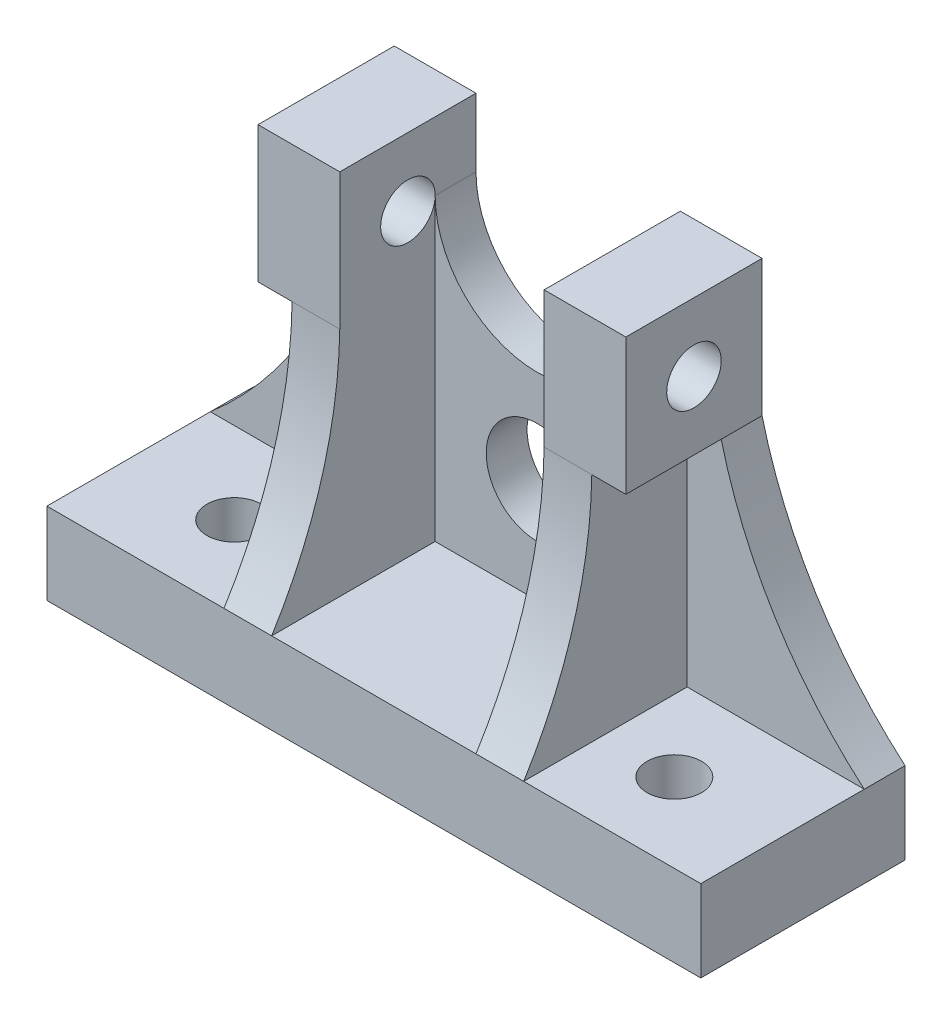
from build123d import *

# Parameters (mm, degrees)
SKETCH1_W             = 96
SKETCH1_H             = 12
BOSS_EXTRUDE1_DEPTH   = 30
SKETCH1_3_R           = 7.5
BOSS_EXTRUDE2_DEPTH   = 6
SKETCH1_4_W           = 12
SKETCH1_4_H           = 20
BOSS_EXTRUDE3_DEPTH   = 20
BOSS_EXTRUDE4_DEPTH   = 7
F_8_0MM_DOWEL_HOLE1_D = 8
F_8_0MM_DOWEL_HOLE2_D = 8


with BuildPart() as part:
    # Sketch1 → Boss-Extrude1 (new body)
    with BuildSketch(Plane.XY):
        with Locations((0, 6)):
            Rectangle(SKETCH1_W, SKETCH1_H)
    extrude(amount=BOSS_EXTRUDE1_DEPTH)

    # Sketch1<3> → Boss-Extrude2 (add)
    with BuildSketch(Plane.XY):
        with BuildLine():
            Line((-15, 46), (-27, 46))
            ThreePointArc((-27, 46), (-34.864825613, 27.37239229), (-48, 12))
            Line((-48, 12), (48, 12))
            ThreePointArc((48, 12), (34.864825613, 27.37239229), (27, 46))
            Line((27, 46), (15, 46))
            Line((15, 46), (15, 56))
            ThreePointArc((15, 56), (0, 41), (-15, 56))
            Line((-15, 56), (-15, 46))
        make_face()
        with Locations((0, 27)):
            Circle(SKETCH1_3_R, mode=Mode.SUBTRACT)
    extrude(amount=BOSS_EXTRUDE2_DEPTH)

    # Sketch1<4> → Boss-Extrude3 (add)
    with BuildSketch(Plane.XY):
        with Locations((-21, 56)):
            Rectangle(SKETCH1_4_W, SKETCH1_4_H)
        with Locations((21, 56)):
            Rectangle(SKETCH1_4_W, SKETCH1_4_H)
    extrude(amount=BOSS_EXTRUDE3_DEPTH)

    # Sketch2 → Boss-Extrude4 (add)
    with BuildSketch(Plane(origin=(-15, 0, 0), x_dir=(0, 0, -1), z_dir=(1, 0, 0))):
        with BuildLine():
            Line((-20, 46), (-6, 46))
            Line((-6, 46), (-6, 12))
            Line((-6, 12), (-30, 12))
            ThreePointArc((-30, 12), (-22.675193853, 28.316233486), (-20, 46))
        make_face()
    boss_extrude4 = extrude(amount=-BOSS_EXTRUDE4_DEPTH)

    # Mirror1: Boss-Extrude4 across plane
    add(boss_extrude4.mirror(Plane(origin=(0, 0, 0), x_dir=(0, 0, 1), z_dir=(1, 0, 0))))

    # Ø8.0mm Dowel Hole1 (through all)
    with Locations(Plane(origin=(-27, 56, 10), x_dir=(0, -1, 0), z_dir=(-1, 0, 0))):
        with Locations((0, 0)):
            Hole(F_8_0MM_DOWEL_HOLE1_D / 2)

    # Ø8.0mm Dowel Hole2 (through all)
    with Locations(Plane(origin=(-32.5, 12, 18), x_dir=(0, 0, 1), z_dir=(0, 1, 0))):
        with Locations((0, 0), (0.381139368, 64.99888255)):
            Hole(F_8_0MM_DOWEL_HOLE2_D / 2)


solid = part.part
